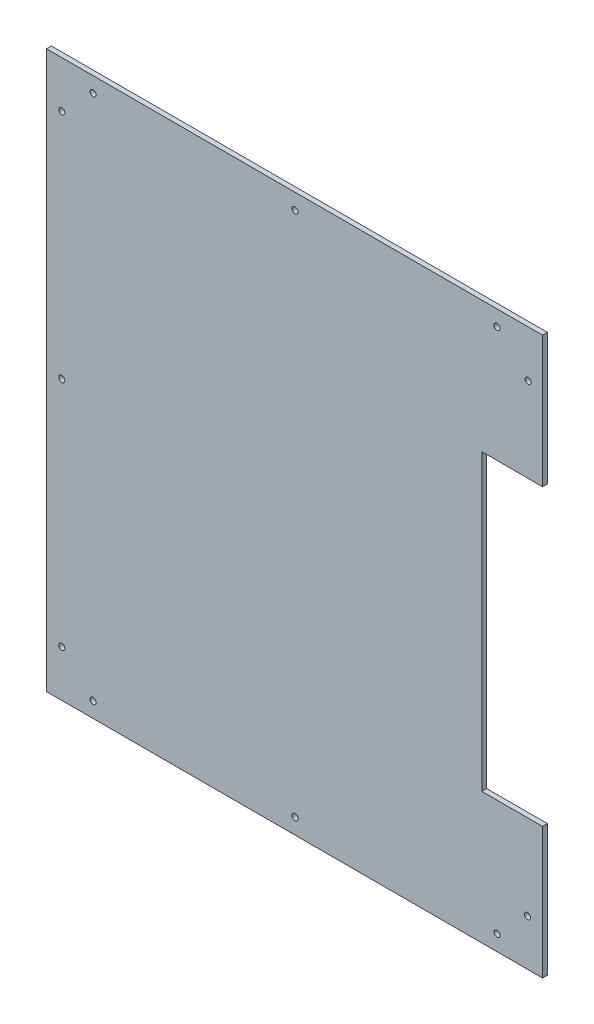
from build123d import *

# Parameters (mm, degrees)
SKETCH1_R           = 2.5
BOSS_EXTRUDE1_DEPTH = 4


with BuildPart() as part:
    # Sketch1 → Boss-Extrude1 (new body)
    with BuildSketch(Plane.XY):
        Polygon((181.321497127, 204.5460303), (-226.678502873, 204.5460303), (-226.678502873, -253.4539697), (181.321497127, -253.4539697), (181.321497127, -145.4539697), (131.321497127, -145.4539697), (131.321497127, 96.5460303), (181.321497127, 96.5460303), align=None)
        with Locations((-214.178502873, -215.246862919)):
            Circle(SKETCH1_R, mode=Mode.SUBTRACT)
        with Locations((-188.471396092, -240.907728533)):
            Circle(SKETCH1_R, mode=Mode.SUBTRACT)
        with Locations((-22.324949482, -240.60041631)):
            Circle(SKETCH1_R, mode=Mode.SUBTRACT)
        with Locations((143.821776426, -240.640809696)):
            Circle(SKETCH1_R, mode=Mode.SUBTRACT)
        with Locations((168.874598055, -215.554555333)):
            Circle(SKETCH1_R, mode=Mode.SUBTRACT)
        with Locations((169.487625208, 166.030738683)):
            Circle(SKETCH1_R, mode=Mode.SUBTRACT)
        with Locations((143.821776426, 191.732870295)):
            Circle(SKETCH1_R, mode=Mode.SUBTRACT)
        with Locations((-22.324949482, 191.692476909)):
            Circle(SKETCH1_R, mode=Mode.SUBTRACT)
        with Locations((-188.471396092, 191.999789133)):
            Circle(SKETCH1_R, mode=Mode.SUBTRACT)
        with Locations((-214.178502873, 166.338923519)):
            Circle(SKETCH1_R, mode=Mode.SUBTRACT)
        with Locations((-214.178502873, -24.4539697)):
            Circle(SKETCH1_R, mode=Mode.SUBTRACT)
    extrude(amount=BOSS_EXTRUDE1_DEPTH)


solid = part.part
